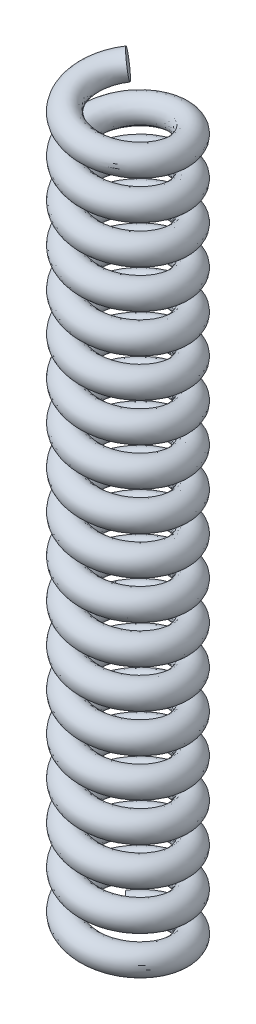
from build123d import *

# Parameters (mm, degrees)
SWEEP1_PITCH       = 3
SWEEP1_HEIGHT      = 57
SWEEP1_RADIUS      = 3.5
SWEEP1_START_ANGLE = -135
SWEEP1_PROFILE_R   = 1


with BuildPart() as part:
    # Sweep1: sweep along a helix
    with BuildLine() as sweep1_path:
        add(Helix(SWEEP1_PITCH, SWEEP1_HEIGHT, SWEEP1_RADIUS, center=(0, 0, 0), direction=(0, 1, 0), lefthand=True, mode=Mode.PRIVATE).rotate(Axis((0, 0, 0), (0, 1, 0)), SWEEP1_START_ANGLE))
    # Sweep1 profile (on start of the path) → Sweep1 (sweep)
    with BuildSketch(Plane(origin=(-2.474873734, 0, -2.474873734), x_dir=(0.7071067811864948, 0, 0.7071067811866002), z_dir=(0.7006175817714526, 0.13516659434042924, -0.7006175817713481))):
        Circle(SWEEP1_PROFILE_R)
    sweep(path=sweep1_path.line, is_frenet=True)


solid = part.part
